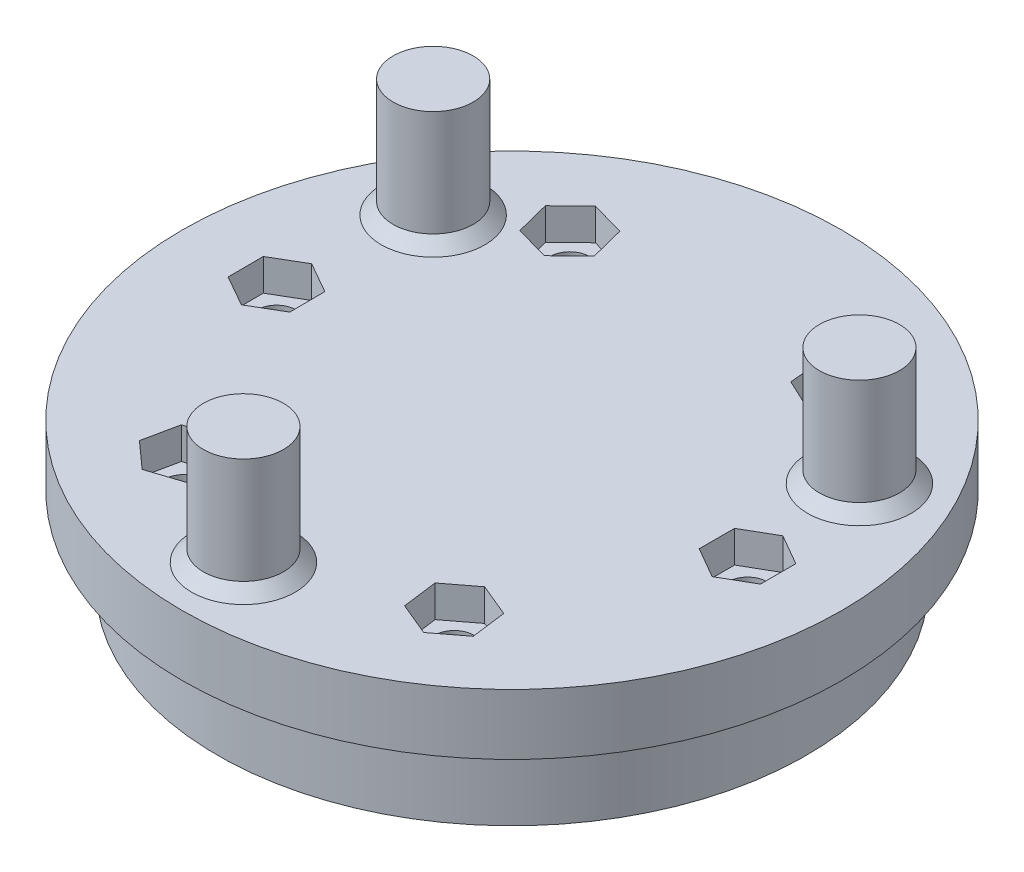
from build123d import *

# Parameters (mm, degrees)
SKETCH3_R               = 28
BOSS_EXTRUDE1_DEPTH     = 5.15
SKETCH6_R               = 25
BOSS_EXTRUDE4_DEPTH     = 7
SKETCH7_R               = 3.4
BOSS_EXTRUDE5_DEPTH     = 10
CUT_EXTRUDE1_DEPTH      = 10
CUT_EXTRUDE1_DEPTH_BACK = 43.3971992
SKETCH8_R               = 1.65
CUT_EXTRUDE3_DEPTH      = 2.7
CHAMFER1_SIZE           = 1


with BuildPart() as part:
    # Sketch3 → Boss-Extrude1 (new body)
    with BuildSketch(Plane(origin=(0, 0, 0), x_dir=(1, 0, 0), z_dir=(0, 1, 0))):
        with Locations(Location((0, 0, 0), (0, 0, 90))):
            Circle(SKETCH3_R)
    extrude(amount=BOSS_EXTRUDE1_DEPTH)

    # Sketch6 → Boss-Extrude4 (add)
    with BuildSketch(Plane.XZ):
        with Locations(Location((0, 0, 0), (0, 0, 270))):
            Circle(SKETCH6_R)
    extrude(amount=BOSS_EXTRUDE4_DEPTH)

    # Sketch7 → Boss-Extrude5 (add)
    with BuildSketch(Plane(origin=(0, 5.15, 0), x_dir=(1, 0, 0), z_dir=(0, 1, 0))):
        with Locations(Location((-0.954174099, -21.854179847, 0), (0, 0, 270))):
            Circle(SKETCH7_R)
        with Locations(Location((-18.449187877, 11.753428933, 0), (0, 0, 270))):
            Circle(SKETCH7_R)
        with Locations(Location((19.403361976, 10.100750915, 0), (0, 0, 270))):
            Circle(SKETCH7_R)
    extrude(amount=BOSS_EXTRUDE5_DEPTH)

    # Sketch8 → Cut-Extrude1 (cut, two sides: drawn at the far end of the back side and taken through both)
    with BuildSketch(Plane.XZ.offset(-CUT_EXTRUDE1_DEPTH_BACK)):
        with Locations(Location((20, 0, 0), (0, 0, 90))):
            Circle(SKETCH8_R)
        with Locations(Location((-20, 0, 0), (0, 0, 90))):
            Circle(SKETCH8_R)
        with Locations(Location((11.471528727, 16.383040886, 0), (0, 0, 90))):
            Circle(SKETCH8_R)
        with Locations(Location((-11.471528727, -16.383040886, 0), (0, 0, 90))):
            Circle(SKETCH8_R)
        with Locations(Location((11.471528727, -16.383040886, 0), (0, 0, 90))):
            Circle(SKETCH8_R)
        with Locations(Location((-11.471528727, 16.383040886, 0), (0, 0, 90))):
            Circle(SKETCH8_R)
    extrude(amount=CUT_EXTRUDE1_DEPTH + CUT_EXTRUDE1_DEPTH_BACK, mode=Mode.SUBTRACT)

    # Sketch11 → Cut-Extrude3 (cut)
    with BuildSketch(Plane(origin=(0, 5.15, 0), x_dir=(1, 0, 0), z_dir=(0, 1, 0))):
        Polygon((11.858091258, -19.360271603), (14.243167426, -17.536883273), (13.856604896, -14.559652555), (11.084966196, -13.405810169), (8.699890028, -15.229198499), (9.086452558, -18.206429216), align=None)
        Polygon((-12.091418901, -19.320568674), (-9.237500125, -18.388645418), (-8.617609951, -15.45111763), (-10.851638553, -13.445513098), (-13.705557329, -14.377436353), (-14.325447503, -17.314964141), align=None)
        Polygon((-22.590586111, -1.517299224), (-19.981273382, -3.002162995), (-17.390687271, -1.48486377), (-17.409413889, 1.517299224), (-20.018726618, 3.002162995), (-22.609312729, 1.48486377), align=None)
        Polygon((20, -3.0022214), (22.6, -1.5011107), (22.6, 1.5011107), (20, 3.0022214), (17.4, 1.5011107), (17.4, -1.5011107), align=None)
        Polygon((9.008253879, 14.666762832), (11.726231698, 13.391643264), (14.189506546, 15.107921318), (13.934803575, 18.09931894), (11.216825756, 19.374438507), (8.753550908, 17.658160453), align=None)
        Polygon((-10.729703857, 13.473912288), (-8.581237024, 15.57091577), (-9.323061894, 18.480044367), (-12.213353597, 19.292169483), (-14.36182043, 17.195166002), (-13.61999556, 14.286037405), align=None)
    extrude(amount=-CUT_EXTRUDE3_DEPTH, mode=Mode.SUBTRACT)

    # Chamfer1
    chamfer1_edges = [part.edges().sort_by_distance(p)[0] for p in [
        (-18.449187877, 5.15, -15.153428933),
        (-0.954174099, 5.15, 18.454179847),
        (19.403361976, 5.15, -13.500750915),
    ]]
    chamfer(chamfer1_edges, length=CHAMFER1_SIZE)


solid = part.part
